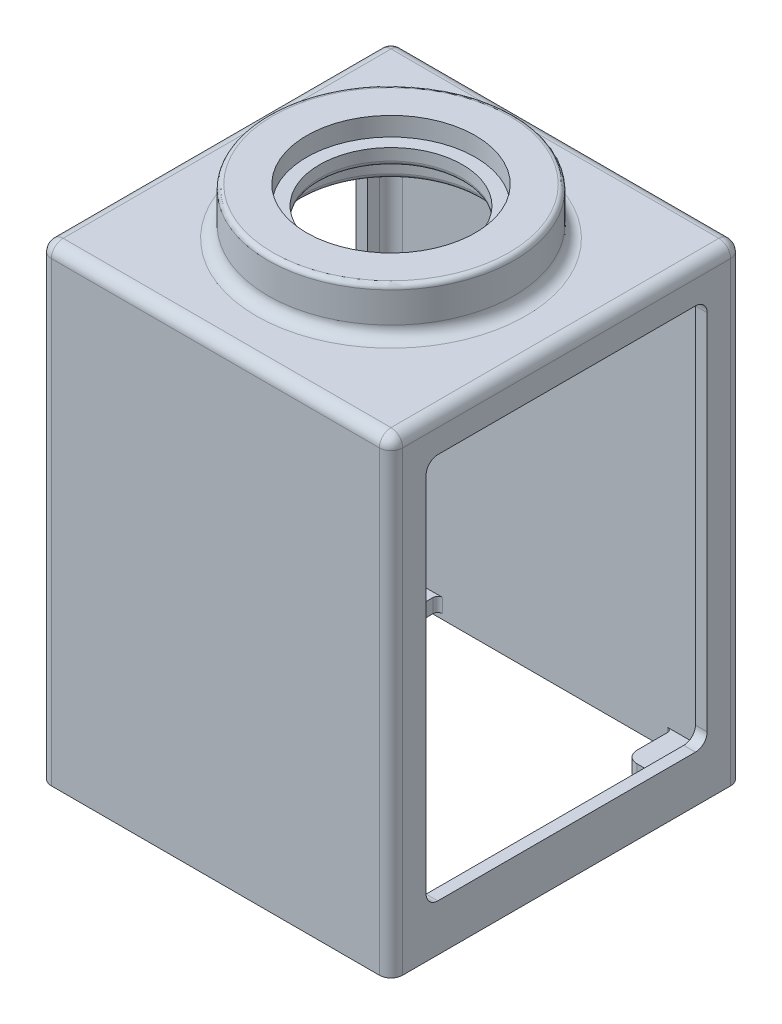
from build123d import *

# Parameters (mm, degrees)
SKETCH1_R           = 66.675
BOSS_EXTRUDE1_DEPTH = 25.4
SKETCH3_R           = 45.72
CUT_EXTRUDE3_DEPTH  = 10.16
FILLET1_R           = 2.54
BOSS_EXTRUDE2_DEPTH = 254
FILLET2_R           = 6.35
CUT_EXTRUDE4_DEPTH  = 247.65
SKETCH7_R           = 38.735
CUT_EXTRUDE5_DEPTH  = 21.59
FILLET3_R           = 6.35
CUT_EXTRUDE6_REACH  = 333.48
SKETCH9_R           = 48.26
CUT_EXTRUDE7_DEPTH  = 12.7
FILLET4_R           = 2.54
BOSS_EXTRUDE3_DEPTH = 7.62
FILLET5_R           = 2.54
SKETCH11_R          = 2.2352
CUT_EXTRUDE8_DEPTH  = 6.7564


with BuildPart() as part:
    # Sketch1 → Boss-Extrude1 (new body)
    with BuildSketch(Plane(origin=(0, 0, 0), x_dir=(1, 0, 0), z_dir=(0, 1, 0))):
        with Locations(Location((0, 0, 0), (0, 0, 270))):
            Circle(SKETCH1_R)
    extrude(amount=BOSS_EXTRUDE1_DEPTH)

    # Sketch3 → Cut-Extrude3 (cut)
    with BuildSketch(Plane(origin=(0, 25.4, 0), x_dir=(1, 0, 0), z_dir=(0, 1, 0))):
        with Locations(Location((0, 0, 0), (0, 0, 270))):
            Circle(SKETCH3_R)
    extrude(amount=-CUT_EXTRUDE3_DEPTH, mode=Mode.SUBTRACT)

    # Fillet1
    fillet1_edges = [part.edges().sort_by_distance(p)[0] for p in [
        (0, 25.4, -66.675),
    ]]
    fillet(fillet1_edges, radius=FILLET1_R)

    # Sketch4 → Boss-Extrude2 (add)
    with BuildSketch(Plane.XZ):
        with BuildLine():
            Line((88.9, 95.25), (-88.9, 95.25))
            ThreePointArc((-88.9, 95.25), (-93.390128061, 93.390128061), (-95.25, 88.9))
            Line((-95.25, 88.9), (-95.25, -88.9))
            ThreePointArc((-95.25, -88.9), (-93.390128061, -93.390128061), (-88.9, -95.25))
            Line((-88.9, -95.25), (88.9, -95.25))
            ThreePointArc((88.9, -95.25), (93.390128061, -93.390128061), (95.25, -88.9))
            Line((95.25, -88.9), (95.25, 88.9))
            ThreePointArc((95.25, 88.9), (93.390128061, 93.390128061), (88.9, 95.25))
        make_face()
    extrude(amount=BOSS_EXTRUDE2_DEPTH)

    # Fillet2
    fillet2_edges = [part.edges().sort_by_distance(p)[0] for p in [
        (-93.390128061, 0, -93.390128061),
        (0, 0, -95.25),
        (93.390128061, 0, -93.390128061),
        (95.25, 0, 0),
        (93.390128061, 0, 93.390128061),
        (0, 0, 95.25),
        (-93.390128061, 0, 93.390128061),
        (-95.25, 0, 0),
    ]]
    fillet(fillet2_edges, radius=FILLET2_R)

    # Sketch5 → Cut-Extrude4 (cut)
    with BuildSketch(Plane.XZ.offset(254)):
        with BuildLine():
            Line((88.9, -82.55), (88.9, 82.55))
            ThreePointArc((88.9, 82.55), (87.040128061, 87.040128061), (82.55, 88.9))
            Line((82.55, 88.9), (-82.55, 88.9))
            ThreePointArc((-82.55, 88.9), (-87.040128061, 87.040128061), (-88.9, 82.55))
            Line((-88.9, 82.55), (-88.9, -82.55))
            ThreePointArc((-88.9, -82.55), (-87.040128061, -87.040128061), (-82.55, -88.9))
            Line((-82.55, -88.9), (82.55, -88.9))
            ThreePointArc((82.55, -88.9), (87.040128061, -87.040128061), (88.9, -82.55))
        make_face()
    extrude(amount=-CUT_EXTRUDE4_DEPTH, mode=Mode.SUBTRACT)

    # Sketch7 → Cut-Extrude5 (cut)
    with BuildSketch(Plane(origin=(0, 15.24, 0), x_dir=(1, 0, 0), z_dir=(0, 1, 0))):
        with Locations(Location((0, 0, 0), (0, 0, 270))):
            Circle(SKETCH7_R)
    extrude(amount=-CUT_EXTRUDE5_DEPTH, mode=Mode.SUBTRACT)

    # Fillet3
    fillet3_edges = [part.edges().sort_by_distance(p)[0] for p in [
        (0, 0, -66.675),
    ]]
    fillet(fillet3_edges, radius=FILLET3_R)

    # Cut-Extrude6: up to this face of the body (flat: up to its plane)
    cut_extrude6_end = Plane(part.part.faces().sort_by_distance((95.25, -130.175, 0))[0])
    # Sketch8 → Cut-Extrude6 (cut, up to the picked face)
    with BuildSketch(Plane.ZY.offset(95.25), mode=Mode.PRIVATE) as cut_extrude6_sk1:
        with BuildLine():
            Line((-69.85, -228.6), (69.85, -228.6))
            ThreePointArc((69.85, -228.6), (74.340128061, -226.740128061), (76.2, -222.25))
            Line((76.2, -222.25), (76.2, -25.4))
            ThreePointArc((76.2, -25.4), (74.340128061, -20.909871939), (69.85, -19.05))
            Line((69.85, -19.05), (-69.85, -19.05))
            ThreePointArc((-69.85, -19.05), (-74.340128061, -20.909871939), (-76.2, -25.4))
            Line((-76.2, -25.4), (-76.2, -222.25))
            ThreePointArc((-76.2, -222.25), (-74.340128061, -226.740128061), (-69.85, -228.6))
        make_face()
    cut_extrude6_tool1 = split(extrude(cut_extrude6_sk1.sketch, amount=-CUT_EXTRUDE6_REACH, mode=Mode.PRIVATE), bisect_by=cut_extrude6_end, keep=Keep.BOTH, mode=Mode.PRIVATE)
    add(cut_extrude6_tool1.solids().sort_by(Axis((-95.25, -123.825, 0), (1, 0, 0)))[0], mode=Mode.SUBTRACT)

    # Sketch9 → Cut-Extrude7 (cut)
    with BuildSketch(Plane.XZ.offset(6.35)):
        with Locations(Location((0, 0, 0), (0, 0, 270))):
            Circle(SKETCH9_R)
    extrude(amount=-CUT_EXTRUDE7_DEPTH, mode=Mode.SUBTRACT)

    # Fillet4
    fillet4_edges = [part.edges().sort_by_distance(p)[0] for p in [
        (0, -6.35, 48.26),
        (0, 6.35, 48.26),
        (0, 6.35, -38.735),
    ]]
    fillet(fillet4_edges, radius=FILLET4_R)

    # Sketch10 → Boss-Extrude3 (add)
    with BuildSketch(Plane(origin=(0, -251.206, 0), x_dir=(-1, 0, 0), z_dir=(0, -1, 0))):
        with BuildLine():
            Line((88.9, 63.5), (69.85, 63.5))
            ThreePointArc((69.85, 63.5), (65.359871939, 65.359871939), (63.5, 69.85))
            Line((63.5, 69.85), (63.5, 88.9))
            Line((63.5, 88.9), (88.9, 88.9))
            Line((88.9, 88.9), (88.9, 63.5))
        make_face()
        with BuildLine():
            Line((88.9, -88.9), (63.5, -88.9))
            Line((63.5, -88.9), (63.5, -69.85))
            ThreePointArc((63.5, -69.85), (65.359871939, -65.359871939), (69.85, -63.5))
            Line((69.85, -63.5), (88.9, -63.5))
            Line((88.9, -63.5), (88.9, -88.9))
        make_face()
        with BuildLine():
            Line((-88.9, -63.5), (-88.9, -88.9))
            Line((-88.9, -88.9), (-63.5, -88.9))
            Line((-63.5, -88.9), (-63.5, -69.85))
            ThreePointArc((-63.5, -69.85), (-65.359871939, -65.359871939), (-69.85, -63.5))
            Line((-69.85, -63.5), (-88.9, -63.5))
        make_face()
        with BuildLine():
            Line((-88.9, 88.9), (-63.5, 88.9))
            Line((-63.5, 88.9), (-63.5, 69.85))
            ThreePointArc((-63.5, 69.85), (-65.359871939, 65.359871939), (-69.85, 63.5))
            Line((-69.85, 63.5), (-88.9, 63.5))
            Line((-88.9, 63.5), (-88.9, 88.9))
        make_face()
    extrude(amount=-BOSS_EXTRUDE3_DEPTH)

    # Fillet5
    fillet5_edges = [part.edges().sort_by_distance(p)[0] for p in [
        (88.9, -247.396, -63.5),
        (63.5, -247.396, -88.9),
        (63.5, -247.396, 88.9),
        (88.9, -247.396, 63.5),
        (-88.9, -247.396, 63.5),
        (-63.5, -247.396, 88.9),
        (-63.5, -247.396, -88.9),
        (-88.9, -247.396, -63.5),
    ]]
    fillet(fillet5_edges, radius=FILLET5_R)

    # Sketch11 → Cut-Extrude8 (cut)
    with BuildSketch(Plane(origin=(0, -251.206, 0), x_dir=(-1, 0, 0), z_dir=(0, -1, 0))):
        with Locations(Location((76.2, 76.2, 0), (0, 0, 90))):
            Circle(SKETCH11_R)
        with Locations(Location((76.2, -76.2, 0), (0, 0, 270))):
            Circle(SKETCH11_R)
        with Locations(Location((-76.2, -76.2, 0), (0, 0, 90))):
            Circle(SKETCH11_R)
        with Locations(Location((-76.2, 76.2, 0), (0, 0, 270))):
            Circle(SKETCH11_R)
    extrude(amount=-CUT_EXTRUDE8_DEPTH, mode=Mode.SUBTRACT)


solid = part.part
